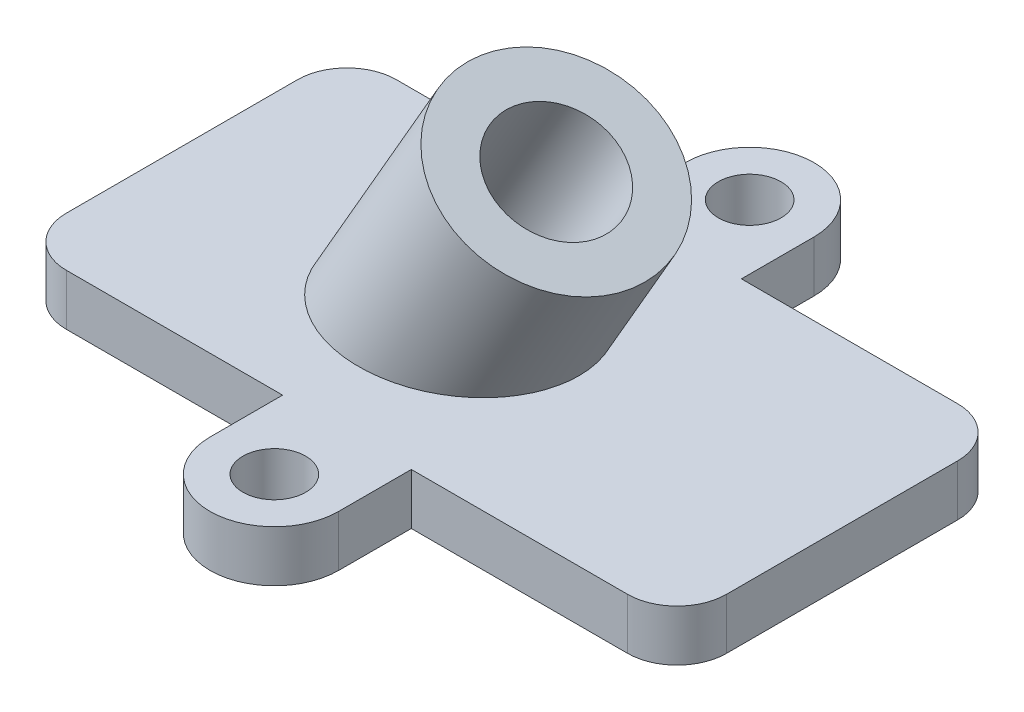
from build123d import *

# Parameters (mm, degrees)
SKETCH1_R           = 9.5
BOSS_EXTRUDE1_DEPTH = 15.5
BOSS_EXTRUDE2_REACH = 167.695
SKETCH2_R           = 31
CUT_EXTRUDE1_REACH  = 167.695
SKETCH3_R           = 17.5


with BuildPart() as part:
    # Sketch1 → Boss-Extrude1 (new body)
    with BuildSketch(Plane(origin=(0, 0, 0), x_dir=(1, 0, 0), z_dir=(0, 1, 0))):
        with BuildLine():
            Line((-85, -50), (-19.5, -50))
            Line((-19.5, -50), (-19.5, -72))
            ThreePointArc((-19.5, -72), (0, -91.5), (19.5, -72))
            Line((19.5, -72), (19.5, -50))
            Line((19.5, -50), (85, -50))
            ThreePointArc((85, -50), (95.606601718, -45.606601718), (100, -35))
            Line((100, -35), (100, 35))
            ThreePointArc((100, 35), (95.606601718, 45.606601718), (85, 50))
            Line((85, 50), (19.5, 50))
            Line((19.5, 50), (19.5, 72))
            ThreePointArc((19.5, 72), (0, 91.5), (-19.5, 72))
            Line((-19.5, 72), (-19.5, 50))
            Line((-19.5, 50), (-85, 50))
            ThreePointArc((-85, 50), (-95.606601718, 45.606601718), (-100, 35))
            Line((-100, 35), (-100, -35))
            ThreePointArc((-100, -35), (-95.606601718, -45.606601718), (-85, -50))
        make_face()
        with Locations(Location((0, -72, 0), (0, 0, 270))):
            Circle(SKETCH1_R, mode=Mode.SUBTRACT)
        with Locations(Location((0, 72, 0), (0, 0, 90))):
            Circle(SKETCH1_R, mode=Mode.SUBTRACT)
    extrude(amount=-BOSS_EXTRUDE1_DEPTH)

    # Boss-Extrude2: up to this plane
    boss_extrude2_end = Plane(origin=(0, 0, 72), z_dir=(0, 1, 0))
    # Sketch2 → Boss-Extrude2 (add, up to the surface)
    with BuildSketch(Plane(origin=(25, 43.301270189, 0), x_dir=(0, 0, -1), z_dir=(0.500000000000001, 0.866025403784438, 0)), mode=Mode.PRIVATE) as boss_extrude2_sk1:
        with Locations(Location((0, 13.397459622, 0), (0, 0, 90))):
            Circle(SKETCH2_R)
    boss_extrude2_tool1 = split(extrude(boss_extrude2_sk1.sketch, amount=-BOSS_EXTRUDE2_REACH, mode=Mode.PRIVATE), bisect_by=boss_extrude2_end, keep=Keep.BOTH, mode=Mode.PRIVATE)
    add(boss_extrude2_tool1.solids().sort_by_distance((13.39746, 50, 0))[0])

    # Cut-Extrude1: up to this plane
    cut_extrude1_end = Plane(origin=(0, -15.5, 72), z_dir=(0, 1, 0))
    # Sketch3 → Cut-Extrude1 (cut, up to the surface)
    with BuildSketch(Plane(origin=(25, 43.301270189, 0), x_dir=(0.8660254037844382, -0.500000000000001, 0), z_dir=(0.500000000000001, 0.8660254037844382, 0)), mode=Mode.PRIVATE) as cut_extrude1_sk1:
        with Locations(Location((-13.397459622, 0, 0), (0, 0, 180))):
            Circle(SKETCH3_R)
    cut_extrude1_tool1 = split(extrude(cut_extrude1_sk1.sketch, amount=-CUT_EXTRUDE1_REACH, mode=Mode.PRIVATE), bisect_by=cut_extrude1_end, keep=Keep.BOTH, mode=Mode.PRIVATE)
    add(cut_extrude1_tool1.solids().sort_by_distance((13.39746, 50, 0))[0], mode=Mode.SUBTRACT)


solid = part.part
